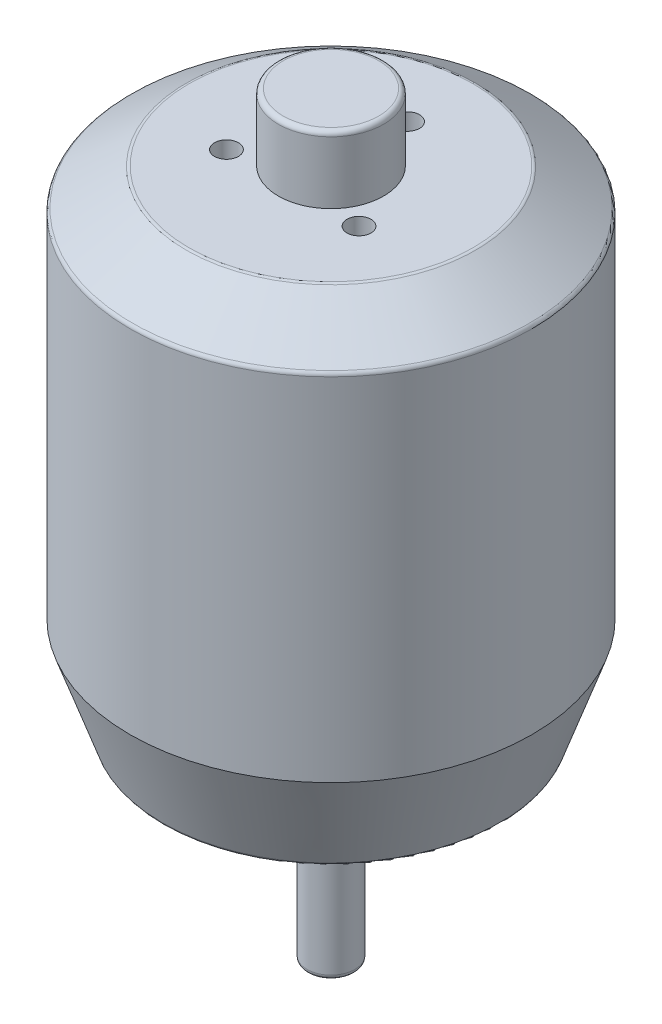
from build123d import *

# Parameters (mm, degrees)
SKETCH1_R           = 17.5
BOSS_EXTRUDE1_DEPTH = 10
SKETCH2_R           = 21
BOSS_EXTRUDE2_DEPTH = 37
SKETCH3_R           = 15
BOSS_EXTRUDE3_DEPTH = 4
SKETCH4_R           = 5.5
BOSS_EXTRUDE4_DEPTH = 7
SKETCH5_R           = 2.5
BOSS_EXTRUDE5_DEPTH = 21
SKETCH6_R           = 1.5
SKETCH6_R_2         = 4
CUT_EXTRUDE1_DEPTH  = 10
BOSS_EXTRUDE6_START = 1
SKETCH7_R           = 5.5
BOSS_EXTRUDE6_DEPTH = 1
SKETCH9_R           = 1.25
CUT_EXTRUDE2_DEPTH  = 10
FILLET1_R           = 0.5


with BuildPart() as part:
    # Sketch1 → Boss-Extrude1 (new body)
    with BuildSketch(Plane(origin=(0, 0, 0), x_dir=(1, 0, 0), z_dir=(0, 1, 0))):
        with Locations(Location((0, 0, 0), (0, 0, 270))):
            Circle(SKETCH1_R)
    extrude(amount=BOSS_EXTRUDE1_DEPTH)

    # Sketch2 → Boss-Extrude2 (add)
    with BuildSketch(Plane(origin=(0, 10, 0), x_dir=(1, 0, 0), z_dir=(0, 1, 0))):
        with Locations(Location((0, 0, 0), (0, 0, 270))):
            Circle(SKETCH2_R)
    extrude(amount=BOSS_EXTRUDE2_DEPTH)

    # Sketch3 → Boss-Extrude3 (add)
    with BuildSketch(Plane(origin=(0, 47, 0), x_dir=(1, 0, 0), z_dir=(0, 1, 0))):
        with Locations(Location((0, 0, 0), (0, 0, 270))):
            Circle(SKETCH3_R)
    extrude(amount=BOSS_EXTRUDE3_DEPTH)

    # Sketch4 → Boss-Extrude4 (add)
    with BuildSketch(Plane(origin=(0, 51, 0), x_dir=(1, 0, 0), z_dir=(0, 1, 0))):
        with Locations(Location((0, 0, 0), (0, 0, 270))):
            Circle(SKETCH4_R)
    extrude(amount=BOSS_EXTRUDE4_DEPTH)

    # Sketch5 → Boss-Extrude5 (add)
    with BuildSketch(Plane.XZ):
        with Locations(Location((0, 0, 0), (0, 0, 90))):
            Circle(SKETCH5_R)
    extrude(amount=BOSS_EXTRUDE5_DEPTH)

    # loft up to a face of the part (loft1)
    loft([Face(Wire([part.edges().sort_by_distance((-12.75695098, 0, -11.979574354))[0]])), Face(Wire([part.edges().sort_by_distance((-15.308341176, 10, -14.375489225))[0]]))])

    # loft up to a face of the part (loft2)
    loft([Face(Wire([part.edges().sort_by_distance((10.934529411, 51, -10.268206589))[0]])), Face(Wire([part.edges().sort_by_distance((15.308341176, 47, -14.375489225))[0]]))])

    # Sketch6 → Cut-Extrude1 (cut)
    with BuildSketch(Plane.XZ):
        with Locations(Location((0, 12.5, 0), (0, 0, 270))):
            Circle(SKETCH6_R)
        with Locations(Location((12.5, 0, 0), (0, 0, 270))):
            Circle(SKETCH6_R)
        with Locations(Location((0, -12.5, 0), (0, 0, 270))):
            Circle(SKETCH6_R)
        with Locations(Location((-12.5, 0, 0), (0, 0, 270))):
            Circle(SKETCH6_R)
        with Locations(Location((-8.838834765, 8.838834765, 0), (0, 0, 270))):
            Circle(SKETCH6_R_2)
        with Locations(Location((8.838834765, 8.838834765, 0), (0, 0, 270))):
            Circle(SKETCH6_R_2)
        with Locations(Location((8.838834765, -8.838834765, 0), (0, 0, 270))):
            Circle(SKETCH6_R_2)
        with Locations(Location((-8.838834765, -8.838834765, 0), (0, 0, 270))):
            Circle(SKETCH6_R_2)
    extrude(amount=-CUT_EXTRUDE1_DEPTH, mode=Mode.SUBTRACT)

    # Sketch7 → Boss-Extrude6 (add)
    with BuildSketch(Plane.XZ.offset(BOSS_EXTRUDE6_START)):
        with Locations(Location((0, 0, 0), (0, 0, 90))):
            Circle(SKETCH7_R)
    extrude(amount=-BOSS_EXTRUDE6_DEPTH)

    # Sketch9 → Cut-Extrude2 (cut)
    with BuildSketch(Plane(origin=(0, 51, 0), x_dir=(1, 0, 0), z_dir=(0, 1, 0))):
        with Locations(Location((0, 8, 0), (0, 0, 270))):
            Circle(SKETCH9_R)
        with Locations(Location((6.92820323, -4, 0), (0, 0, 270))):
            Circle(SKETCH9_R)
        with Locations(Location((-6.92820323, -4, 0), (0, 0, 270))):
            Circle(SKETCH9_R)
    extrude(amount=-CUT_EXTRUDE2_DEPTH, mode=Mode.SUBTRACT)

    # Fillet1
    fillet1_edges = [part.edges().sort_by_distance(p)[0] for p in [
        (0, 58, -5.5),
        (0, 0, -17.5),
        (0, -21, -2.5),
        (0, 47, -21),
        (0, 51, -15),
    ]]
    fillet(fillet1_edges, radius=FILLET1_R)


solid = part.part
